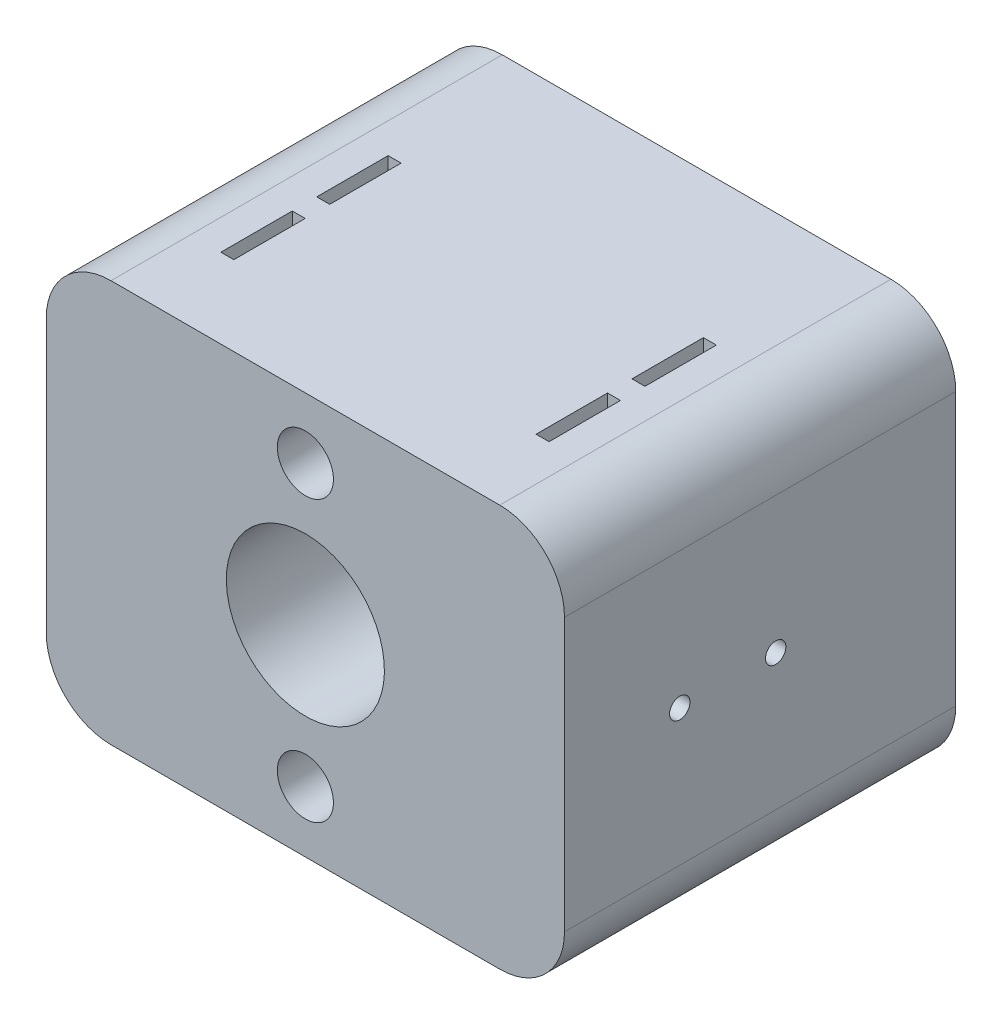
from build123d import *

# Parameters (mm, degrees)
SKETCH1_W               = 50.8
SKETCH1_H               = 39.395334333
SKETCH1_R               = 2.75
SKETCH1_R_2             = 7.747
BOSS_EXTRUDE1_DEPTH     = 38.35
CUT_EXTRUDE1_DEPTH      = 100.182747326
CUT_EXTRUDE1_DEPTH_BACK = 100.182747326
SKETCH2_W               = 1.27
SKETCH2_H               = 7
CUT_EXTRUDE2_DEPTH      = 71.04748878
CUT_EXTRUDE2_DEPTH_BACK = 71.04748878
SKETCH3_R               = 1
FILLET1_R               = 6.35


with BuildPart() as part:
    # Sketch1 → Boss-Extrude1 (new body)
    with BuildSketch(Plane.XY):
        with Locations((-57.15, 9.547643302)):
            Rectangle(SKETCH1_W, SKETCH1_H)
        with Locations(Location((-57.15, 23.269976885, 0), (0, 0, 180))):
            Circle(SKETCH1_R, mode=Mode.SUBTRACT)
        with Locations(Location((-57.15, -4.174690282, 0), (0, 0, 180))):
            Circle(SKETCH1_R, mode=Mode.SUBTRACT)
        with Locations(Location((-57.15, 9.547643302, 0), (0, 0, 180))):
            Circle(SKETCH1_R_2, mode=Mode.SUBTRACT)
    extrude(amount=BOSS_EXTRUDE1_DEPTH)

    # Sketch2 → Cut-Extrude1 (cut, two sides: drawn at the far end of the back side and taken through both)
    with BuildSketch(Plane(origin=(0, -10.150023865, 0), x_dir=(-1, 0, 0), z_dir=(0, -1, 0)).offset(-CUT_EXTRUDE1_DEPTH_BACK)):
        with Locations((72.6, -17.65)):
            Rectangle(SKETCH2_W, SKETCH2_H)
        with Locations((41.7, -27.05)):
            Rectangle(SKETCH2_W, SKETCH2_H)
        with Locations((41.7, -17.65)):
            Rectangle(SKETCH2_W, SKETCH2_H)
        with Locations((72.6, -27.05)):
            Rectangle(SKETCH2_W, SKETCH2_H)
    extrude(amount=CUT_EXTRUDE1_DEPTH + CUT_EXTRUDE1_DEPTH_BACK, mode=Mode.SUBTRACT)

    # Sketch3 → Cut-Extrude2 (cut, two sides: drawn at the far end of the back side and taken through both)
    with BuildSketch(Plane(origin=(-31.75, 0, 0), x_dir=(0, 0, -1), z_dir=(1, 0, 0)).offset(-CUT_EXTRUDE2_DEPTH_BACK)):
        with Locations((-17.65, 9.547643302)):
            Circle(SKETCH3_R)
        with Locations(Location((-27.05, 9.547643302, 0), (0, 0, 90))):
            Circle(SKETCH3_R)
    extrude(amount=CUT_EXTRUDE2_DEPTH + CUT_EXTRUDE2_DEPTH_BACK, mode=Mode.SUBTRACT)

    # Fillet1
    fillet1_edges = [part.edges().sort_by_distance(p)[0] for p in [
        (-31.75, -10.150023865, 19.175),
        (-82.55, -10.150023865, 19.175),
        (-82.55, 29.245310468, 19.175),
        (-31.75, 29.245310468, 19.175),
    ]]
    fillet(fillet1_edges, radius=FILLET1_R)


solid = part.part
